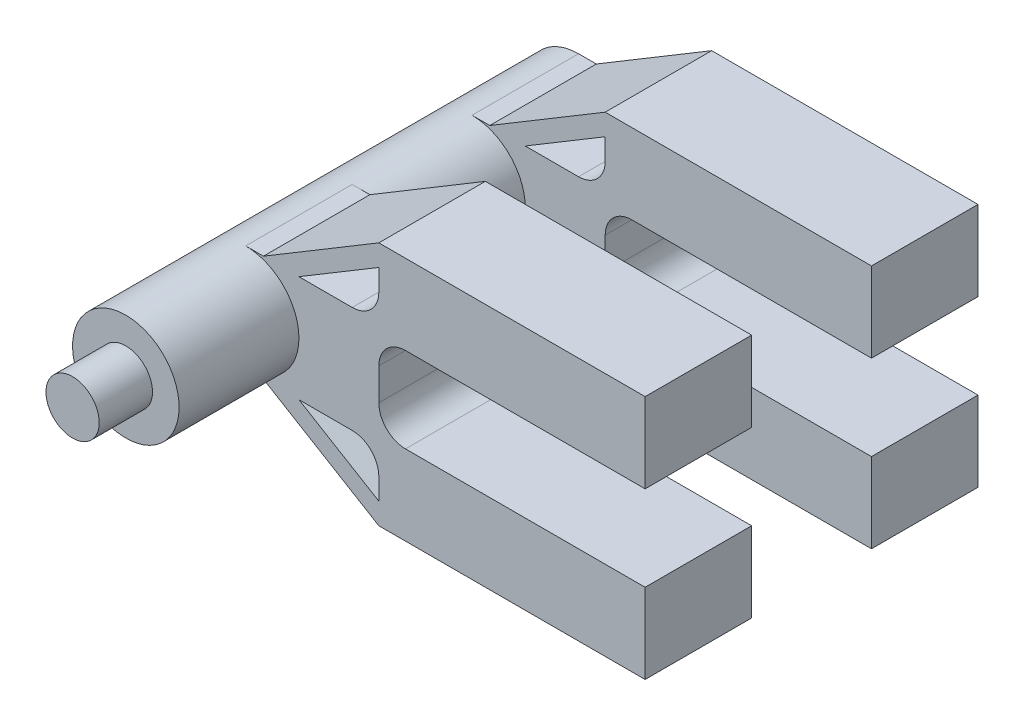
from build123d import *

# Parameters (mm, degrees)
SKETCH_1_R      = 20
EXTRUDE_1_DEPTH = 170
SKETCH_2_W      = 40
SKETCH_2_H      = 40
EXTRUDE_2_DEPTH = 50
SKETCH_3_W      = 100
SKETCH_3_H      = 30
EXTRUDE_3_DEPTH = 40
SKETCH_4_W      = 100
SKETCH_4_H      = 30
EXTRUDE_4_DEPTH = 40
FILLET_1_R      = 10
EXTRUDE_6_DEPTH = 20
EXTRUDE_7_DEPTH = 20
SKETCH_10_R     = 10
EXTRUDE_8_DEPTH = 20


with BuildPart() as part:
    # 스케치1 → 보스-돌출1 (new body)
    with BuildSketch(Plane.XY):
        Circle(SKETCH_1_R)
    extrude(amount=EXTRUDE_1_DEPTH)

    # 스케치2 → 보스-돌출2 (add)
    with BuildSketch(Plane(origin=(0, 0, 0), x_dir=(0, 0, -1), z_dir=(1, 0, 0))):
        with Locations((-20, 0)):
            Rectangle(SKETCH_2_W, SKETCH_2_H)
        with Locations((-105, 0)):
            Rectangle(SKETCH_2_W, SKETCH_2_H)
    extrude(amount=EXTRUDE_2_DEPTH)

    # 스케치3 → 보스-돌출3 (add)
    with BuildSketch(Plane(origin=(0, 0, 0), x_dir=(-1, 0, 0), z_dir=(0, 0, -1))):
        with Locations((-100, -31)):
            Rectangle(SKETCH_3_W, SKETCH_3_H)
        with Locations((-100, 31)):
            Rectangle(SKETCH_3_W, SKETCH_3_H)
    extrude(amount=-EXTRUDE_3_DEPTH)

    # 스케치4 → 보스-돌출4 (add)
    with BuildSketch(Plane(origin=(0, 0, 85), x_dir=(-1, 0, 0), z_dir=(0, 0, -1))):
        with Locations((-100, -31)):
            Rectangle(SKETCH_4_W, SKETCH_4_H)
        with Locations((-100, 31)):
            Rectangle(SKETCH_4_W, SKETCH_4_H)
    extrude(amount=-EXTRUDE_4_DEPTH)

    # 필렛1
    fillet_1_edges = [part.edges().sort_by_distance(p)[0] for p in [
        (50, -20, 20),
        (50, 20, 105),
        (50, -20, 105),
        (50, -16, 20),
        (50, 16, 20),
        (50, -16, 105),
        (50, 16, 105),
        (50, 20, 20),
    ]]
    fillet(fillet_1_edges, radius=FILLET_1_R)

    # 스케치11 → 보스-돌출6 (add, symmetric)
    with BuildSketch(Plane.XY.offset(20)):
        Polygon((20, 20), (50, 38), (50, 46), (6.666666667, 20), align=None)
        Polygon((20, -20), (50, -38), (50, -46), (6.666666667, -20), align=None)
    extrude(amount=EXTRUDE_6_DEPTH, both=True)

    # 스케치13 → 보스-돌출7 (add, symmetric)
    with BuildSketch(Plane.XY.offset(105)):
        Polygon((20, 20), (50, 38), (50, 46), (6.666666667, 20), align=None)
        Polygon((20, -20), (6.666666667, -20), (50, -46), (50, -38), align=None)
    extrude(amount=EXTRUDE_7_DEPTH, both=True)

    # 스케치10 → 보스-돌출8 (add)
    with BuildSketch(Plane.XY.offset(170)):
        Circle(SKETCH_10_R)
    extrude(amount=EXTRUDE_8_DEPTH)


solid = part.part
